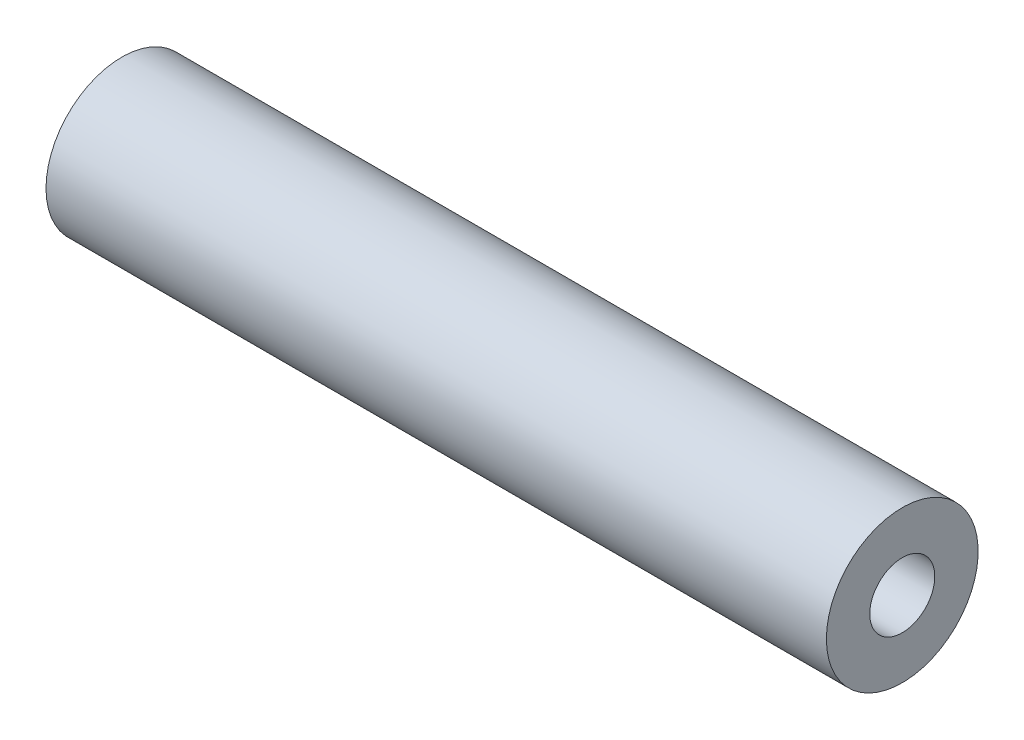
from build123d import *

# Parameters (mm, degrees)
SKETCH1_W = 180
SKETCH1_H = 10


with BuildPart() as part:
    # Sketch1 → Revolve1 (revolve)
    with BuildSketch(Plane.XY, mode=Mode.PRIVATE) as revolve1_sk:
        with Locations((120, 12.5)):
            Rectangle(SKETCH1_W, SKETCH1_H)
    revolve(revolve1_sk.sketch.rotate(Axis((0, 0, 0), (1, 0, 0)), 90), axis=Axis((0, 0, 0), (1, 0, 0)))


solid = part.part
